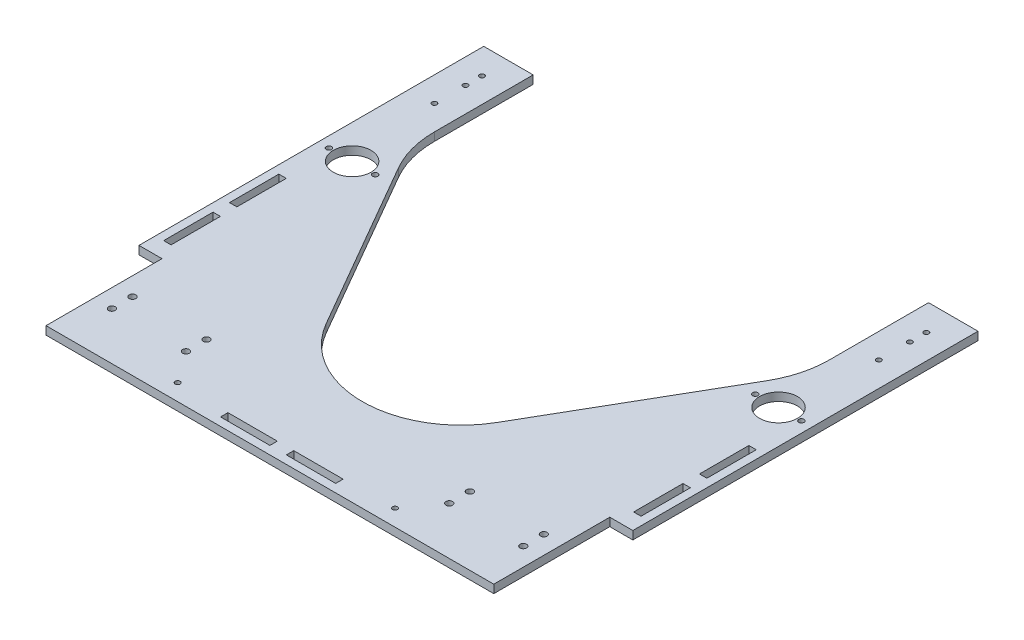
from build123d import *

# Parameters (mm, degrees)
SKETCH2_R           = 1.625
SKETCH2_R_2         = 11.5
SKETCH2_R_3         = 2
SKETCH2_R_4         = 1.5
SKETCH2_W           = 30
SKETCH2_H           = 4.5
SKETCH2_W_2         = 4.5
SKETCH2_H_2         = 30
BOSS_EXTRUDE1_DEPTH = 5


with BuildPart() as part:
    # Sketch2 → Boss-Extrude1 (new body)
    with BuildSketch(Plane(origin=(0, 0, 0), x_dir=(1, 0, 0), z_dir=(0, 1, 0))):
        with BuildLine():
            Line((-120, 42.726979343), (-120, 102.67073807))
            Line((-120, 102.67073807), (-150.055809303, 102.67073807))
            Line((-150.055809303, 102.67073807), (-150.055809303, -106.82926193))
            Line((-150.055809303, -106.82926193), (-136.055809303, -106.82926193))
            Line((-136.055809303, -106.82926193), (-136.055809303, -177.32926193))
            Line((-136.055809303, -177.32926193), (136.055809303, -177.32926193))
            Line((136.055809303, -177.32926193), (136.055809303, -106.82926193))
            Line((136.055809303, -106.82926193), (150.055809303, -106.82926193))
            Line((150.055809303, -106.82926193), (150.055809303, 102.923994861))
            Line((150.055809303, 102.923994861), (120, 102.923994861))
            Line((120, 102.923994861), (120, 87.604878279))
            Line((120, 87.604878279), (120, 42.726979343))
            ThreePointArc((120, 42.726979343), (117.955549577, 27.197836637), (111.961524227, 12.726979343))
            Line((111.961524227, 12.726979343), (51.961524227, -91.196069111))
            ThreePointArc((51.961524227, -91.196069111), (0, -121.196069111), (-51.961524227, -91.196069111))
            Line((-51.961524227, -91.196069111), (-111.961524227, 12.726979343))
            ThreePointArc((-111.961524227, 12.726979343), (-117.955549577, 27.197836637), (-120, 42.726979343))
        make_face()
        with Locations(Location((-143.555809303, 2.104507355, 0), (0, 0, 270))):
            Circle(SKETCH2_R, mode=Mode.SUBTRACT)
        with Locations(Location((-115.5, 2.104507355, 0), (0, 0, 270))):
            Circle(SKETCH2_R, mode=Mode.SUBTRACT)
        with Locations(Location((115.5, 2.104507355, 0), (0, 0, 270))):
            Circle(SKETCH2_R, mode=Mode.SUBTRACT)
        with Locations(Location((143.555809303, 2.104507355, 0), (0, 0, 270))):
            Circle(SKETCH2_R, mode=Mode.SUBTRACT)
        with Locations(Location((129.555809303, 2.201175016, 0), (0, 0, 270))):
            Circle(SKETCH2_R_2, mode=Mode.SUBTRACT)
        with Locations(Location((-129.555809303, 2.201175016, 0), (0, 0, 270))):
            Circle(SKETCH2_R_2, mode=Mode.SUBTRACT)
        with Locations(Location((-125, -135.82926193, 0), (0, 0, 270))):
            Circle(SKETCH2_R_3, mode=Mode.SUBTRACT)
        with Locations(Location((-125, -148.32926193, 0), (0, 0, 270))):
            Circle(SKETCH2_R_3, mode=Mode.SUBTRACT)
        with Locations(Location((-80, -135.82926193, 0), (0, 0, 270))):
            Circle(SKETCH2_R_3, mode=Mode.SUBTRACT)
        with Locations(Location((-80, -148.32926193, 0), (0, 0, 270))):
            Circle(SKETCH2_R_3, mode=Mode.SUBTRACT)
        with Locations(Location((80, -135.82926193, 0), (0, 0, 270))):
            Circle(SKETCH2_R_3, mode=Mode.SUBTRACT)
        with Locations(Location((80, -148.32926193, 0), (0, 0, 270))):
            Circle(SKETCH2_R_3, mode=Mode.SUBTRACT)
        with Locations(Location((125, -148.32926193, 0), (0, 0, 270))):
            Circle(SKETCH2_R_3, mode=Mode.SUBTRACT)
        with Locations(Location((125, -135.82926193, 0), (0, 0, 270))):
            Circle(SKETCH2_R_3, mode=Mode.SUBTRACT)
        with Locations(Location((-135.027904651, 86.57073807, 0), (0, 0, 270))):
            Circle(SKETCH2_R_4, mode=Mode.SUBTRACT)
        with Locations(Location((-135.027904651, 76.57073807, 0), (0, 0, 270))):
            Circle(SKETCH2_R_4, mode=Mode.SUBTRACT)
        with Locations(Location((135.027904651, 76.57073807, 0), (0, 0, 270))):
            Circle(SKETCH2_R_4, mode=Mode.SUBTRACT)
        with Locations(Location((135.027904651, 86.57073807, 0), (0, 0, 270))):
            Circle(SKETCH2_R_4, mode=Mode.SUBTRACT)
        with Locations(Location((-135.027904651, 57.67073807, 0), (0, 0, 270))):
            Circle(SKETCH2_R_4, mode=Mode.SUBTRACT)
        with Locations(Location((135.027904651, 57.67073807, 0), (0, 0, 270))):
            Circle(SKETCH2_R_4, mode=Mode.SUBTRACT)
        with Locations(Location((66.055809303, -167.32926193, 0), (0, 0, 270))):
            Circle(SKETCH2_R_4, mode=Mode.SUBTRACT)
        with Locations(Location((-66.055809303, -167.32926193, 0), (0, 0, 270))):
            Circle(SKETCH2_R_4, mode=Mode.SUBTRACT)
        with Locations((-20, -170.07926193)):
            Rectangle(SKETCH2_W, SKETCH2_H, mode=Mode.SUBTRACT)
        with Locations((20, -170.07926193)):
            Rectangle(SKETCH2_W, SKETCH2_H, mode=Mode.SUBTRACT)
        with Locations((142.805809303, -81.82926193)):
            Rectangle(SKETCH2_W_2, SKETCH2_H_2, mode=Mode.SUBTRACT)
        with Locations((142.805809303, -41.82926193)):
            Rectangle(SKETCH2_W_2, SKETCH2_H_2, mode=Mode.SUBTRACT)
        with Locations((-142.805809303, -81.82926193)):
            Rectangle(SKETCH2_W_2, SKETCH2_H_2, mode=Mode.SUBTRACT)
        with Locations((-142.805809303, -41.82926193)):
            Rectangle(SKETCH2_W_2, SKETCH2_H_2, mode=Mode.SUBTRACT)
    extrude(amount=BOSS_EXTRUDE1_DEPTH)


solid = part.part
